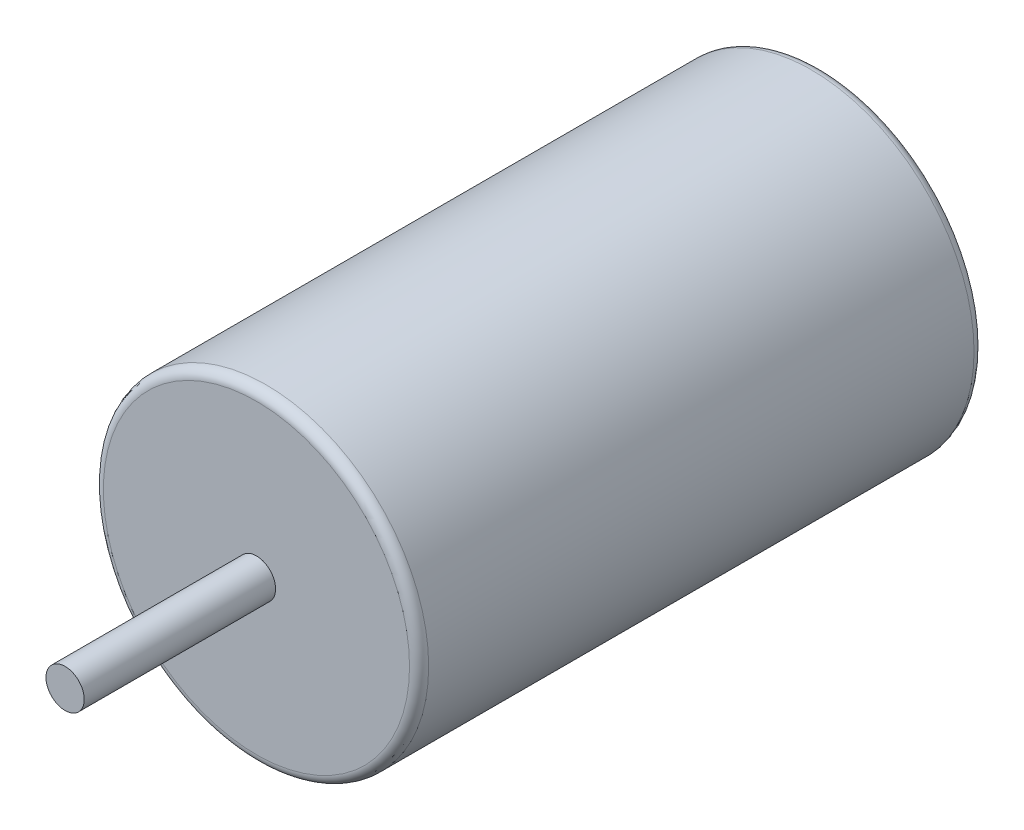
from build123d import *

# Parameters (mm, degrees)
SKETCH1_R           = 34
BOSS_EXTRUDE1_DEPTH = 118
SKETCH2_R           = 4
BOSS_EXTRUDE2_DEPTH = 40
FILLET1_R           = 2


with BuildPart() as part:
    # Sketch1 → Boss-Extrude1 (new body)
    with BuildSketch(Plane.XY):
        Circle(SKETCH1_R)
    extrude(amount=BOSS_EXTRUDE1_DEPTH)

    # Sketch2 → Boss-Extrude2 (add)
    with BuildSketch(Plane.XY.offset(118)):
        Circle(SKETCH2_R)
    extrude(amount=BOSS_EXTRUDE2_DEPTH)

    # Fillet1
    fillet1_edges = [part.edges().sort_by_distance(p)[0] for p in [
        (-34, 0, 0),
        (-34, 0, 118),
    ]]
    fillet(fillet1_edges, radius=FILLET1_R)


solid = part.part
